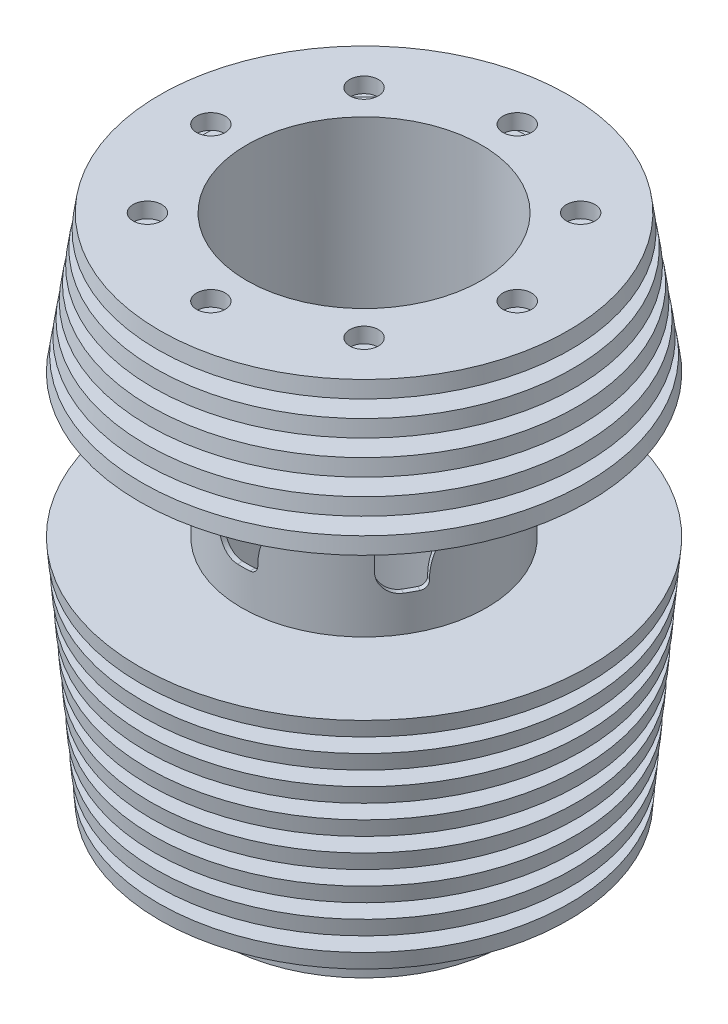
from build123d import *

# Parameters (mm, degrees)
SKETCH2_R          = 11.5
CUT_EXTRUDE1_DEPTH = 64.190189112
SKETCH3_R          = 1.4
CUT_EXTRUDE2_DEPTH = 1.5
CUT_EXTRUDE4_DEPTH = 64.190189112
CIRPATTERN1_COUNT  = 6


with BuildPart() as part:
    # Sketch1 → Revolve1 (revolve)
    with BuildSketch(Plane.XY, mode=Mode.PRIVATE) as revolve1_sk:
        Polygon((0, 0), (-20, 0), (-20.222222222, -1.5), (-16, -1.5), (-16, -3), (-20.444444444, -3), (-20.666666667, -4.5), (-13, -4.5), (-13, -6), (-20.888888889, -6), (-21.111111111, -7.5), (-13, -7.5), (-13, -9), (-21.333333333, -9), (-21.555555556, -10.5), (-13, -10.5), (-13, -12), (-21.777777778, -12), (-22, -13.5), (-12, -13.5), (-12, -27.5), (-22, -27.5), (-21.866666667, -29), (-13, -29), (-13, -30.5), (-21.733333333, -30.5), (-21.6, -32), (-13, -32), (-13, -33.5), (-21.466666667, -33.5), (-21.333333333, -35), (-13, -35), (-13, -36.5), (-21.2, -36.5), (-21.066666667, -38), (-13, -38), (-13, -39.5), (-20.933333333, -39.5), (-20.8, -41), (-13, -41), (-13, -42.5), (-20.666666667, -42.5), (-20.533333333, -44), (-13, -44), (-13, -45.5), (-20.4, -45.5), (-20.266666667, -47), (-13, -47), (-13, -48.5), (-20.133333333, -48.5), (-20, -50), (-14, -50), (-14, -55), (0, -55), (0, -50), align=None)
    revolve(revolve1_sk.sketch.rotate(Axis((0, 9.036108318, 0), (0, -1, 0)), 270), axis=Axis((0, 9.036108318, 0), (0, -1, 0)))

    # Sketch2 → Cut-Extrude1 (cut, through all)
    with BuildSketch(Plane(origin=(0, 0, 0), x_dir=(1, 0, 0), z_dir=(0, 1, 0))):
        with Locations(Location((0, 0, 0), (0, 0, 270))):
            Circle(SKETCH2_R)
    extrude(amount=-CUT_EXTRUDE1_DEPTH, mode=Mode.SUBTRACT)

    # Sketch3 → Cut-Extrude2 (cut)
    with BuildSketch(Plane(origin=(0, 0, 0), x_dir=(1, 0, 0), z_dir=(0, 1, 0))):
        with Locations(Location((0, 15, 0), (0, 0, 270))):
            Circle(SKETCH3_R)
        with Locations(Location((10.606601718, 10.606601718, 0), (0, 0, 270))):
            Circle(SKETCH3_R)
        with Locations(Location((15, 0, 0), (0, 0, 270))):
            Circle(SKETCH3_R)
        with Locations(Location((10.606601718, -10.606601718, 0), (0, 0, 270))):
            Circle(SKETCH3_R)
        with Locations(Location((0, -15, 0), (0, 0, 270))):
            Circle(SKETCH3_R)
        with Locations(Location((-10.606601718, -10.606601718, 0), (0, 0, 270))):
            Circle(SKETCH3_R)
        with Locations(Location((-15, 0, 0), (0, 0, 270))):
            Circle(SKETCH3_R)
        with Locations(Location((-10.606601718, 10.606601718, 0), (0, 0, 270))):
            Circle(SKETCH3_R)
    extrude(amount=-CUT_EXTRUDE2_DEPTH, mode=Mode.SUBTRACT)

    # Sketch4 → Cut-Extrude4 (cut, through all)
    with BuildSketch(Plane.XY):
        with BuildLine():
            Line((2.4, -17), (-2.4, -17))
            ThreePointArc((-2.4, -17), (-3.512430627, -17.750002112), (-3.234319055, -19.062503168))
            ThreePointArc((-3.234319055, -19.062503168), (-1.925390847, -20.992226998), (-1.49871035, -23.284621133))
            ThreePointArc((-1.49871035, -23.284621133), (-1.299261763, -23.7895073), (-0.798879306, -24))
            Line((-0.798879306, -24), (0.4, -24))
            ThreePointArc((0.4, -24), (1.814213562, -23.414213562), (2.4, -22))
            Line((2.4, -22), (2.4, -17))
        make_face()
    cut_extrude4 = extrude(amount=-CUT_EXTRUDE4_DEPTH, mode=Mode.SUBTRACT)

    # CirPattern1: Cut-Extrude4 ×6 about axis
    cirpattern1_axis = Axis((0, 0, 0), (0, 1, 0))
    for i in range(1, CIRPATTERN1_COUNT):
        add(cut_extrude4.rotate(cirpattern1_axis, i * 360 / CIRPATTERN1_COUNT), mode=Mode.SUBTRACT)


solid = part.part
